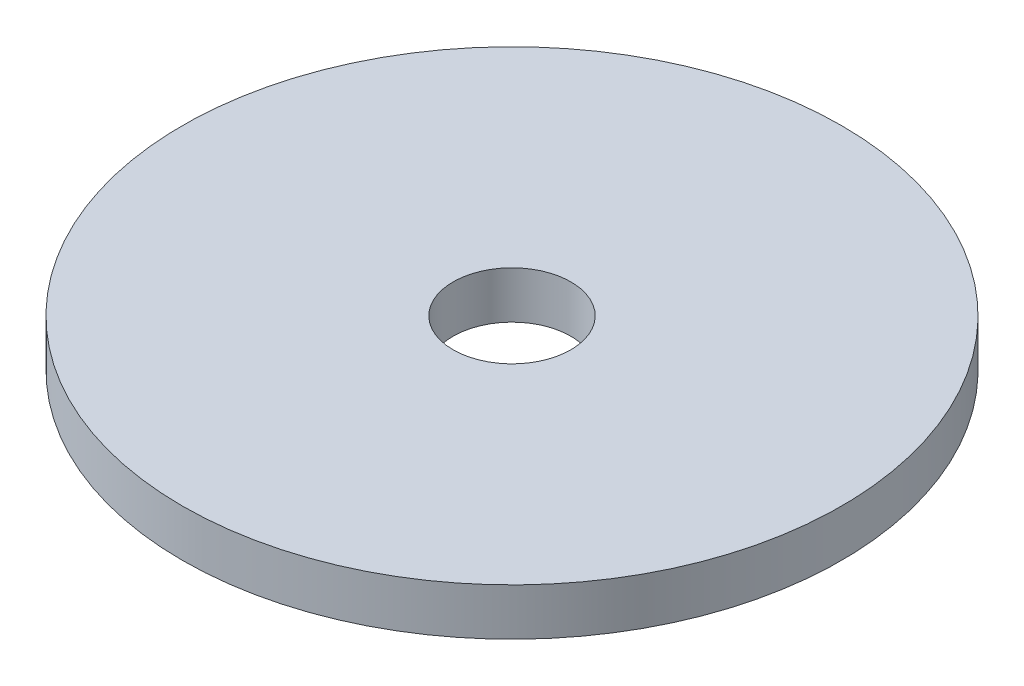
from build123d import *

# Parameters (mm, degrees)
SKETCH1_R           = 14
BOSS_EXTRUDE1_DEPTH = 2
SKETCH2_R           = 2.5
CUT_EXTRUDE2_DEPTH  = 6


with BuildPart() as part:
    # Sketch1 → Boss-Extrude1 (new body)
    with BuildSketch(Plane(origin=(0, 0, 0), x_dir=(1, 0, 0), z_dir=(0, 1, 0))):
        with Locations(Location((0, 0, 0), (0, 0, 270))):
            Circle(SKETCH1_R)
    extrude(amount=BOSS_EXTRUDE1_DEPTH)

    # Sketch2 → Cut-Extrude2 (cut)
    with BuildSketch(Plane(origin=(0, 0, 0), x_dir=(1, 0, 0), z_dir=(0, 1, 0))):
        with Locations(Location((0, 0, 0), (0, 0, 270))):
            Circle(SKETCH2_R)
    extrude(amount=CUT_EXTRUDE2_DEPTH, mode=Mode.SUBTRACT)


solid = part.part
